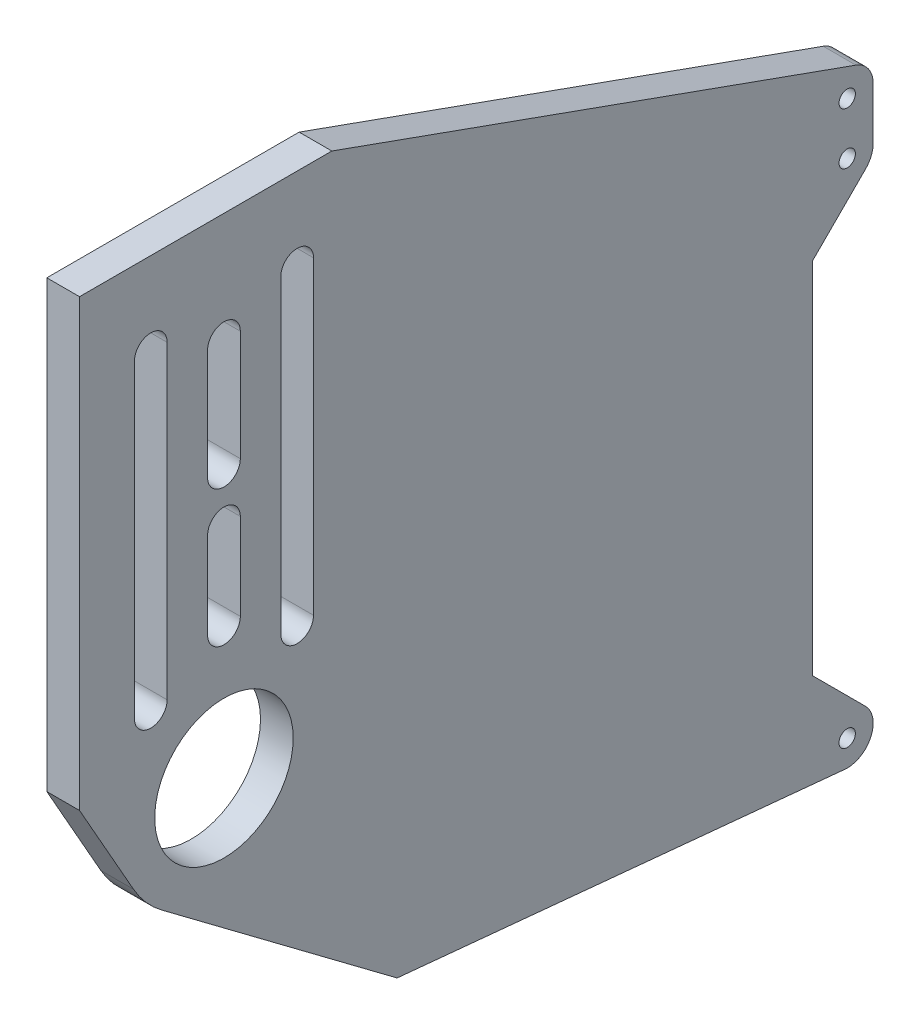
from build123d import *

# Parameters (mm, degrees)
SKETCH4_R           = 1.5
SKETCH4_R_2         = 19.05
SKETCH4_R_3         = 12.7
BOSS_EXTRUDE1_DEPTH = 3


with BuildPart() as part:
    # Sketch4 → Boss-Extrude1 (new, symmetric)
    # profile 1 of 3: a face of its own
    with BuildSketch(Plane(origin=(0, 0, 0), x_dir=(0, 0, -1), z_dir=(1, 0, 0))):
        with BuildLine():
            ThreePointArc((47.817596045, 22.032403955), (48.849976274, 23.577470153), (49.2125, 25.4))
            Line((49.2125, 25.4), (49.2125, 34.925))
            ThreePointArc((49.2125, 34.925), (48.344113354, 37.66676721), (46.055633886, 39.40867551))
            Line((46.055633886, 39.40867551), (-50.063626234, 73.829618952))
            Line((-50.063626234, 73.829618952), (-96.337100071, 73.829618952))
            Line((-96.337100071, 73.829618952), (-96.337100071, -7.774310331))
            Line((-96.337100071, -7.774310331), (-86.423631694, -25.267402912))
            ThreePointArc((-86.423631694, -25.267402912), (-74.706686948, 2.545507373), (-50.8, -15.875))
            ThreePointArc((-50.8, -15.875), (-61.330581006, -32.913837989), (-81.28, -31.115))
            Line((-81.28, -31.115), (-38.1, -63.5))
            Line((-38.1, -63.5), (43.992912904, -71.415514491))
            ThreePointArc((43.992912904, -71.415514491), (48.757334408, -68.706816071), (47.817596045, -63.307403955))
            Line((47.817596045, -63.307403955), (38.1, -53.589807909))
            Line((38.1, -53.589807909), (38.1, 12.314807909))
            Line((38.1, 12.314807909), (47.817596045, 22.032403955))
        make_face()
        with Locations((44.45, -66.675)):
            Circle(SKETCH4_R, mode=Mode.SUBTRACT)
        with BuildLine():
            ThreePointArc((-80.273393759, 1.775), (-83.273393759, -1.225), (-86.273393759, 1.775))
            Line((-86.273393759, 1.775), (-86.273393759, 58.55))
            ThreePointArc((-86.273393759, 58.55), (-83.273393759, 61.55), (-80.273393759, 58.55))
            Line((-80.273393759, 58.55), (-80.273393759, 1.775))
        make_face(mode=Mode.SUBTRACT)
        with BuildLine():
            ThreePointArc((-66.85, 8.3125), (-69.85, 5.3125), (-72.85, 8.3125))
            Line((-72.85, 8.3125), (-72.85, 24.1875))
            Line((-72.85, 24.1875), (-72.85, 33.3625))
            Line((-72.85, 33.3625), (-72.85, 53.6))
            ThreePointArc((-72.85, 53.6), (-69.85, 56.6), (-66.85, 53.6))
            Line((-66.85, 53.6), (-66.85, 33.3625))
            Line((-66.85, 33.3625), (-66.85, 24.1875))
            Line((-66.85, 24.1875), (-66.85, 8.3125))
        make_face(mode=Mode.SUBTRACT)
        with BuildLine():
            ThreePointArc((-53.426606241, 1.775), (-56.426606241, -1.225), (-59.426606241, 1.775))
            Line((-59.426606241, 1.775), (-59.426606241, 58.55))
            ThreePointArc((-59.426606241, 58.55), (-56.426606241, 61.55), (-53.426606241, 58.55))
            Line((-53.426606241, 58.55), (-53.426606241, 1.775))
        make_face(mode=Mode.SUBTRACT)
        with Locations((44.45, 25.4)):
            Circle(SKETCH4_R, mode=Mode.SUBTRACT)
        with Locations((44.45, 34.925)):
            Circle(SKETCH4_R, mode=Mode.SUBTRACT)
    # profile 2 of 3: a face of its own
    with BuildSketch(Plane(origin=(0, 0, 0), x_dir=(0, 0, -1), z_dir=(1, 0, 0))):
        with Locations((-69.85, -15.875)):
            Circle(SKETCH4_R_2)
        with Locations((-69.85, -15.875)):
            Circle(SKETCH4_R_3, mode=Mode.SUBTRACT)
    # profile 3 of 3: a face of its own
    with BuildSketch(Plane(origin=(0, 0, 0), x_dir=(0, 0, -1), z_dir=(1, 0, 0))):
        with BuildLine():
            Line((-72.85, 33.3625), (-72.85, 24.1875))
            ThreePointArc((-72.85, 24.1875), (-69.85, 27.1875), (-66.85, 24.1875))
            Line((-66.85, 24.1875), (-66.85, 33.3625))
            ThreePointArc((-66.85, 33.3625), (-69.85, 30.3625), (-72.85, 33.3625))
        make_face()
    extrude(amount=BOSS_EXTRUDE1_DEPTH, both=True)


solid = part.part
